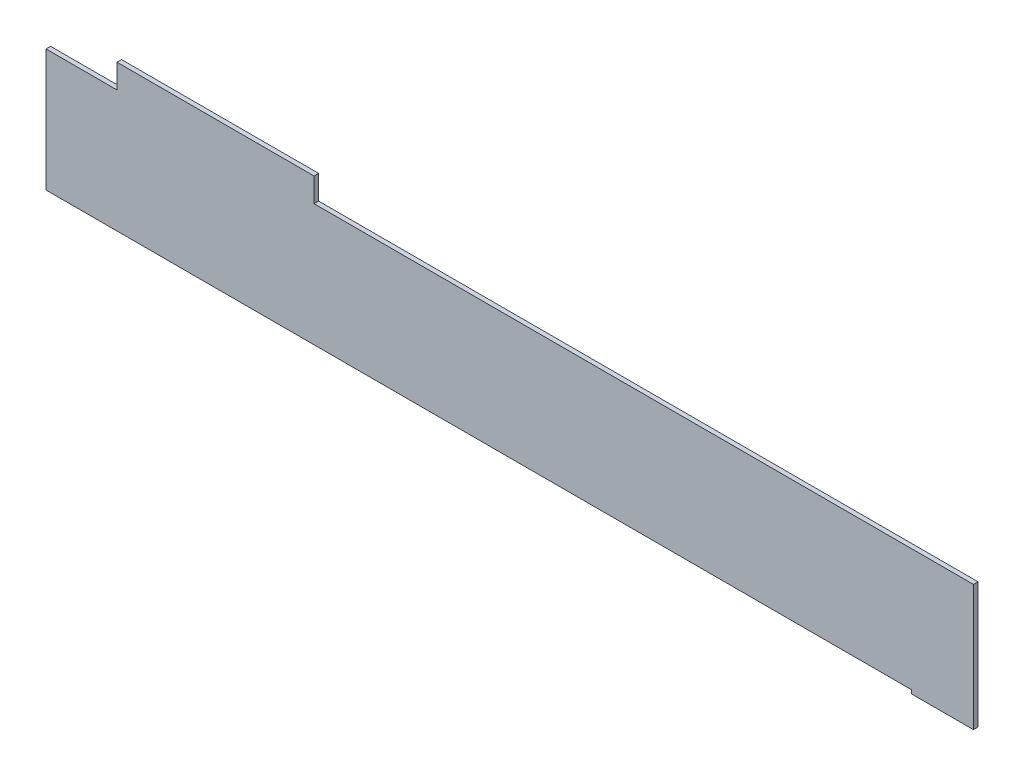
from build123d import *

# Parameters (mm, degrees)
SKETCH1_W           = 647.7
SKETCH1_H           = 85.344
BOSS_EXTRUDE1_DEPTH = 3.175
SKETCH2_W           = 43.18
SKETCH2_H           = 2.54
BOSS_EXTRUDE2_DEPTH = 3.175
SKETCH3_W           = 137.668
SKETCH3_H           = 16.764
BOSS_EXTRUDE3_DEPTH = 3.175


with BuildPart() as part:
    # Sketch1 → Boss-Extrude1 (new body)
    with BuildSketch(Plane.XY):
        with Locations((323.85, 42.672)):
            Rectangle(SKETCH1_W, SKETCH1_H)
    extrude(amount=-BOSS_EXTRUDE1_DEPTH)

    # Sketch2 → Boss-Extrude2 (add)
    with BuildSketch(Plane.XY):
        with Locations((626.11, -1.27)):
            Rectangle(SKETCH2_W, SKETCH2_H)
    extrude(amount=-BOSS_EXTRUDE2_DEPTH)

    # Sketch3 → Boss-Extrude3 (add)
    with BuildSketch(Plane.XY):
        with Locations((118.3894, 93.726)):
            Rectangle(SKETCH3_W, SKETCH3_H)
    extrude(amount=-BOSS_EXTRUDE3_DEPTH)


solid = part.part
